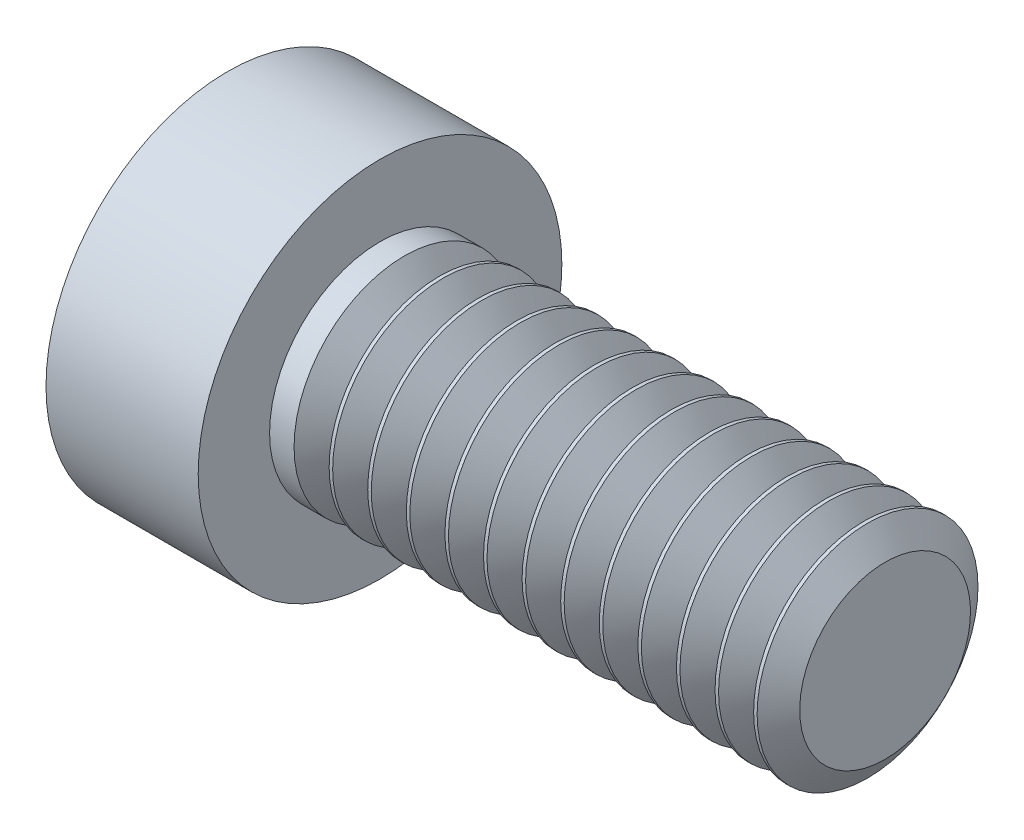
from build123d import *

# Parameters (mm, degrees)
CIRPATTERN1_COUNT = 2
CIRPATTERN1_ANGLE = 90
THDSCHPAT_COUNT   = 13
THDSCHPAT_PITCH   = 0.72771


with BuildPart() as part:
    # BodySke → Base-Revolve (revolve)
    with BuildSketch(Plane.XY, mode=Mode.PRIVATE) as base_revolve_sk:
        with BuildLine():
            Line((3.9624, 2.0828), (3.9624, 3.429))
            Line((3.9624, 3.429), (1.0922, 3.429))
            ThreePointArc((1.0922, 3.429), (0.279645002, 1.799370851), (0, 0))
            Line((0, 0), (13.4874, 0))
            Line((13.4874, 0), (13.4874, 2.0828))
            Line((13.4874, 2.0828), (3.9624, 2.0828))
        make_face()
    revolve(base_revolve_sk.sketch.rotate(Axis((-25.4, 0, 0), (1, 0, 0)), 90), axis=Axis((-25.4, 0, 0), (1, 0, 0)))

    # Sketch3 → Cross section 0
    with BuildSketch(Plane(origin=(0, 0, 0), x_dir=(0, 0, -1), z_dir=(1, 0, 0))):
        with BuildLine():
            Line((0.4953, -2.5654), (-0.4953, -2.5654))
            Line((-0.4953, -2.5654), (-0.4953, 2.5654))
            Line((-0.4953, 2.5654), (0.4953, 2.5654))
            Line((0.4953, 2.5654), (0.4953, -2.5654))
        make_face()
    # Sketch4 → Cross section 1
    with BuildSketch(Plane(origin=(2.9972, 0, 0), x_dir=(0, 0, -1), z_dir=(1, 0, 0))):
        with BuildLine():
            Line((0.24765, -0.24765), (-0.24765, -0.24765))
            Line((-0.24765, -0.24765), (-0.24765, 0.24765))
            Line((-0.24765, 0.24765), (0.24765, 0.24765))
            Line((0.24765, 0.24765), (0.24765, -0.24765))
        make_face()
    cross = loft(mode=Mode.SUBTRACT)

    # CirPattern1: Cross ×2 about axis
    cirpattern1_axis = Axis((0, 0, 0), (1, 0, 0))
    for i in range(1, CIRPATTERN1_COUNT):
        add(cross.rotate(cirpattern1_axis, i * CIRPATTERN1_ANGLE / (CIRPATTERN1_COUNT - 1)), mode=Mode.SUBTRACT)

    # ThdSchSke → ThreadSchematic (revolve, cut)
    with BuildSketch(Plane.XY):
        Polygon((4.75488, -1.61036), (4.424073951, -2.0828), (4.424073951, -2.6035), (5.085686049, -2.6035), (5.085686049, -2.0828), align=None)
    threadschematic = revolve(axis=Axis((-3.175, 0, 0), (1, 0, 0)), mode=Mode.SUBTRACT)

    # ThdSchPat: ThreadSchematic ×13
    with Locations(*[(i * THDSCHPAT_PITCH, 0, 0) for i in range(1, THDSCHPAT_COUNT)]):
        add(threadschematic, mode=Mode.SUBTRACT)


solid = part.part
